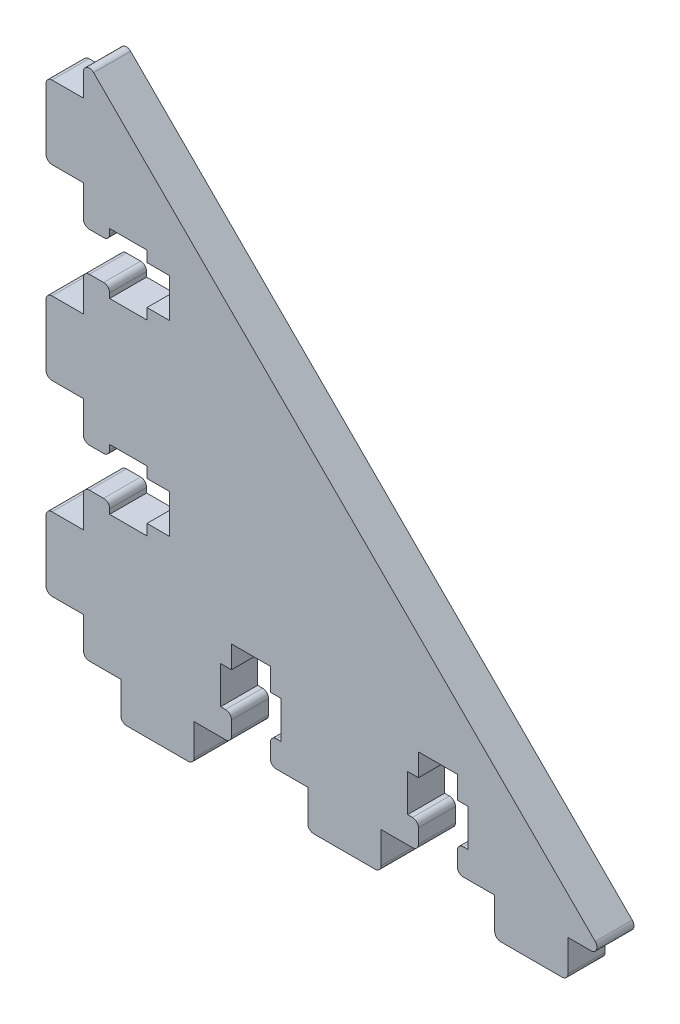
from build123d import *

# Parameters (mm, degrees)
BOSS_EXTRUDE1_DEPTH = 4.95
FILLET1_R           = 0.8


with BuildPart() as part:
    # Sketch2 → Boss-Extrude1 (new body)
    with BuildSketch(Plane.XY):
        Polygon((11.5, 25), (8.5, 25), (8.5, 26.45), (3.5, 26.45), (3.5, 25), (0, 25), (0, 30), (-5, 30), (-5, 39.8), (0, 39.8), (0, 44.8), (3.5, 44.8), (3.5, 43.35), (8.5, 43.35), (8.5, 44.8), (11.5, 44.8), (11.5, 50), (8.5, 50), (8.5, 51.45), (3.5, 51.45), (3.5, 50), (0, 50), (0, 55), (-5, 55), (-5, 64.8), (0, 64.8), (0, 69.8), (69.8, 0), (64.8, 0), (64.8, -5), (55, -5), (55, 0), (50, 0), (50, 3.5), (51.45, 3.5), (51.45, 8.5), (50, 8.5), (50, 11.5), (44.8, 11.5), (44.8, 8.5), (43.35, 8.5), (43.35, 3.5), (44.8, 3.5), (44.8, 0), (39.8, 0), (39.8, -5), (30, -5), (30, 0), (25, 0), (25, 3.5), (26.45, 3.5), (26.45, 8.5), (25, 8.5), (25, 11.5), (19.8, 11.5), (19.8, 8.5), (18.35, 8.5), (18.35, 3.5), (19.8, 3.5), (19.8, 0), (14.8, 0), (14.8, -5), (5, -5), (5, 0), (0, 0), (0, 5), (-5, 5), (-5, 14.8), (0, 14.8), (0, 19.8), (3.5, 19.8), (3.5, 18.35), (8.5, 18.35), (8.5, 19.8), (11.5, 19.8), align=None)
    extrude(amount=BOSS_EXTRUDE1_DEPTH)

    # Fillet1
    fillet1_edges = [part.edges().sort_by_distance(p)[0] for p in [
        (19.8, 3.5, 2.475),
        (19.8, 0, 2.475),
        (14.8, -5, 2.475),
        (5, -5, 2.475),
        (0, 0, 2.475),
        (-5, 5, 2.475),
        (-5, 14.8, 2.475),
        (0, 19.8, 2.475),
        (3.5, 19.8, 2.475),
        (3.5, 25, 2.475),
        (0, 25, 2.475),
        (-5, 30, 2.475),
        (-5, 39.8, 2.475),
        (0, 44.8, 2.475),
        (3.5, 44.8, 2.475),
        (3.5, 50, 2.475),
        (0, 50, 2.475),
        (-5, 55, 2.475),
        (-5, 64.8, 2.475),
        (0, 69.8, 2.475),
        (69.8, 0, 2.475),
        (64.8, -5, 2.475),
        (55, -5, 2.475),
        (50, 0, 2.475),
        (50, 3.5, 2.475),
        (44.8, 3.5, 2.475),
        (44.8, 0, 2.475),
        (39.8, -5, 2.475),
        (30, -5, 2.475),
        (25, 0, 2.475),
        (25, 3.5, 2.475),
    ]]
    fillet(fillet1_edges, radius=FILLET1_R)


solid = part.part
